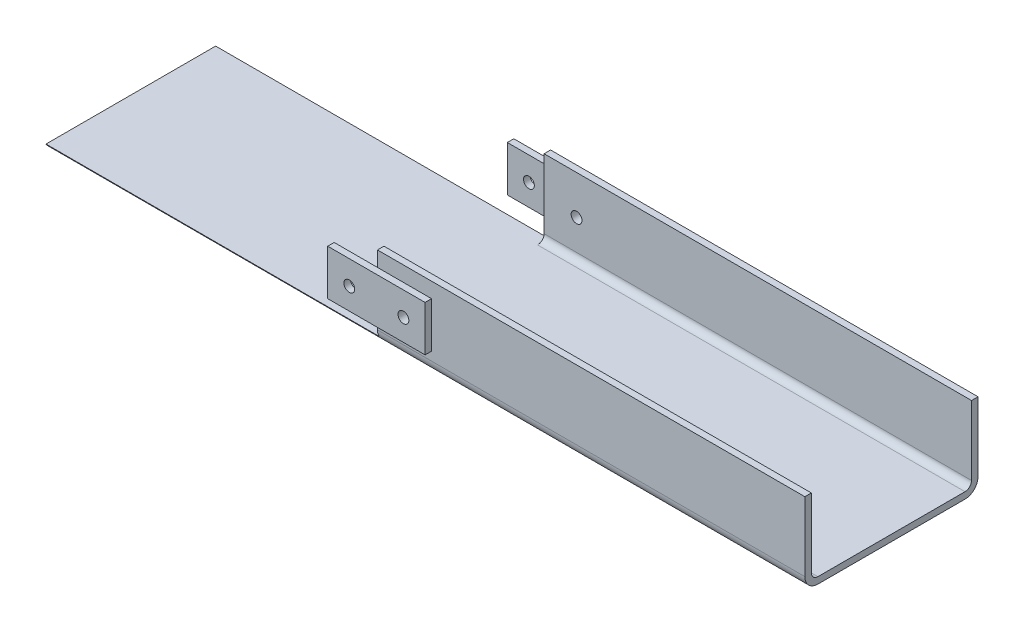
from build123d import *

# Parameters (mm, degrees)
FLOOR_2_DEPTH        = 40
SIDE_START           = 37
SKETCH_2_W           = 197.5
SKETCH_2_H           = 35
SIDE_FRONT_DEPTH     = 3
SIDE_START_2         = -37
SKETCH_3_W           = 197.5
SKETCH_3_H           = 35
SIDE_REAR_DEPTH      = 3
INSIDE_BEND_FRONT_R  = 3
INSIDE_BEND_REAR_R   = 3
OUTSIDE_BEND_FRONT_R = 6
OUTSIDE_BEND_REAR_R  = 6
JOINT_START          = 40
SKETCH_4_W           = 45
SKETCH_4_H           = 21
JOINT_FRONT_DEPTH    = 3
JOINT_START_2        = -40
SKETCH_5_W           = 45
SKETCH_5_H           = 21
JOINT_REAR_DEPTH     = 3
SKETCH_6_R           = 2.5
FIXING_HOLES_DEPTH   = 43


with BuildPart() as part:
    # 草图1 → Floor 2 (new, symmetric)
    with BuildSketch(Plane.XY):
        Polygon((-103.110079617, 0), (247.5, 0), (247.5, 3), (-103.962954093, 3), align=None)
    extrude(amount=FLOOR_2_DEPTH, both=True)

    # 草图2 → Side Front (add)
    with BuildSketch(Plane.XY.offset(SIDE_START)):
        with Locations((148.75, 20.5)):
            Rectangle(SKETCH_2_W, SKETCH_2_H)
    extrude(amount=SIDE_FRONT_DEPTH)

    # 草图3 → Side Rear (add)
    with BuildSketch(Plane.XY.offset(SIDE_START_2)):
        with Locations((148.75, 20.5)):
            Rectangle(SKETCH_3_W, SKETCH_3_H)
    extrude(amount=-SIDE_REAR_DEPTH)

    # Inside Bend Front
    inside_bend_front_edges = [part.edges().sort_by_distance(p)[0] for p in [
        (148.75, 3, 37),
    ]]
    fillet(inside_bend_front_edges, radius=INSIDE_BEND_FRONT_R)

    # Inside Bend Rear
    inside_bend_rear_edges = [part.edges().sort_by_distance(p)[0] for p in [
        (148.75, 3, -37),
    ]]
    fillet(inside_bend_rear_edges, radius=INSIDE_BEND_REAR_R)

    # Outside Bend Front
    outside_bend_front_edges = [part.edges().sort_by_distance(p)[0] for p in [
        (72.194960192, 0, 40),
    ]]
    fillet(outside_bend_front_edges, radius=OUTSIDE_BEND_FRONT_R)

    # Outside Bend Rear
    outside_bend_rear_edges = [part.edges().sort_by_distance(p)[0] for p in [
        (72.194960192, 0, -40),
    ]]
    fillet(outside_bend_rear_edges, radius=OUTSIDE_BEND_REAR_R)

    # 草图4 → Joint Front (add)
    with BuildSketch(Plane.XY.offset(JOINT_START)):
        with Locations((52.5, 20.5)):
            Rectangle(SKETCH_4_W, SKETCH_4_H)
    extrude(amount=JOINT_FRONT_DEPTH)

    # 草图5 → Joint Rear (add)
    with BuildSketch(Plane.XY.offset(JOINT_START_2)):
        with Locations((52.5, 20.5)):
            Rectangle(SKETCH_5_W, SKETCH_5_H)
    extrude(amount=-JOINT_REAR_DEPTH)

    # 草图6 → Fixing Holes (cut, symmetric)
    with BuildSketch(Plane.XY):
        with Locations((40, 20)):
            Circle(SKETCH_6_R)
        with Locations((65, 20)):
            Circle(SKETCH_6_R)
    extrude(amount=FIXING_HOLES_DEPTH, both=True, mode=Mode.SUBTRACT)


solid = part.part
